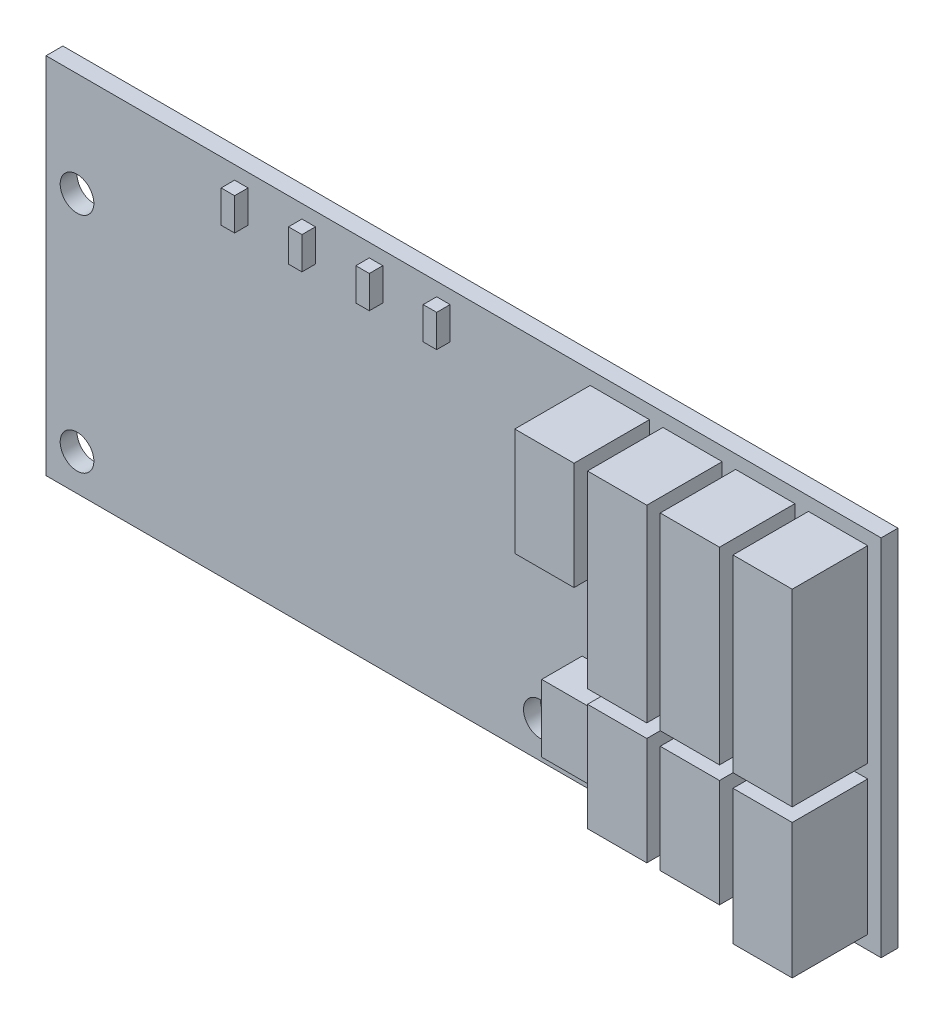
from build123d import *

# Parameters (mm, degrees)
SKETCH1_W           = 78.74
SKETCH1_H           = 34.29
BOSS_EXTRUDE1_DEPTH = 1.5875
CUT_EXTRUDE1_REACH  = 87.897
SKETCH2_R           = 1.5875
SKETCH3_W           = 5.588
SKETCH3_H           = 10.16
SKETCH3_H_2         = 17.78
SKETCH3_H_3         = 12.7
BOSS_EXTRUDE2_DEPTH = 7.112
SKETCH4_W           = 6.35
SKETCH4_H           = 6.35
BOSS_EXTRUDE3_DEPTH = 3.81
BOSS_EXTRUDE4_DEPTH = 4.0005
SKETCH6_W           = 1.27
SKETCH6_H           = 3.048
BOSS_EXTRUDE5_DEPTH = 1.27


with BuildPart() as part:
    # Sketch1 → Boss-Extrude1 (new body)
    with BuildSketch(Plane.XY):
        with Locations((39.37, 17.145)):
            Rectangle(SKETCH1_W, SKETCH1_H)
    extrude(amount=BOSS_EXTRUDE1_DEPTH)

    # Sketch2 → Cut-Extrude1 (cut, up to next)
    with BuildSketch(Plane.XY.offset(1.5875), mode=Mode.PRIVATE) as cut_extrude1_sk1:
        with Locations((2.921, 3.429)):
            Circle(SKETCH2_R)
    cut_extrude1_tool1 = extrude(cut_extrude1_sk1.sketch, amount=-CUT_EXTRUDE1_REACH, mode=Mode.PRIVATE) & part.part
    # Sketch2 → Cut-Extrude1 (cut, up to next)
    with BuildSketch(Plane.XY.offset(1.5875), mode=Mode.PRIVATE) as cut_extrude1_sk2:
        with Locations((2.921, 24.4856)):
            Circle(SKETCH2_R)
    cut_extrude1_tool2 = extrude(cut_extrude1_sk2.sketch, amount=-CUT_EXTRUDE1_REACH, mode=Mode.PRIVATE) & part.part
    # Sketch2 → Cut-Extrude1 (cut, up to next)
    with BuildSketch(Plane.XY.offset(1.5875), mode=Mode.PRIVATE) as cut_extrude1_sk3:
        with Locations((46.609, 24.4856)):
            Circle(SKETCH2_R)
    cut_extrude1_tool3 = extrude(cut_extrude1_sk3.sketch, amount=-CUT_EXTRUDE1_REACH, mode=Mode.PRIVATE) & part.part
    # Sketch2 → Cut-Extrude1 (cut, up to next)
    with BuildSketch(Plane.XY.offset(1.5875), mode=Mode.PRIVATE) as cut_extrude1_sk4:
        with Locations((46.609, 3.429)):
            Circle(SKETCH2_R)
    cut_extrude1_tool4 = extrude(cut_extrude1_sk4.sketch, amount=-CUT_EXTRUDE1_REACH, mode=Mode.PRIVATE) & part.part
    add(cut_extrude1_tool1.solids().sort_by_distance((2.921, 3.429, 1.5875))[0], mode=Mode.SUBTRACT)
    add(cut_extrude1_tool2.solids().sort_by_distance((2.921, 24.4856, 1.5875))[0], mode=Mode.SUBTRACT)
    add(cut_extrude1_tool3.solids().sort_by_distance((46.609, 24.4856, 1.5875))[0], mode=Mode.SUBTRACT)
    add(cut_extrude1_tool4.solids().sort_by_distance((46.609, 3.429, 1.5875))[0], mode=Mode.SUBTRACT)

    # Sketch3 → Boss-Extrude2 (add)
    with BuildSketch(Plane.XY.offset(1.5875)):
        with Locations((54.102, 27.94)):
            Rectangle(SKETCH3_W, SKETCH3_H)
        with Locations((60.96, 24.13)):
            Rectangle(SKETCH3_W, SKETCH3_H_2)
        with Locations((67.818, 24.13)):
            Rectangle(SKETCH3_W, SKETCH3_H_2)
        with Locations((74.676, 24.13)):
            Rectangle(SKETCH3_W, SKETCH3_H_2)
        with Locations((60.96, 8.89)):
            Rectangle(SKETCH3_W, SKETCH3_H)
        with Locations((67.818, 8.89)):
            Rectangle(SKETCH3_W, SKETCH3_H)
        with Locations((74.676, 7.62)):
            Rectangle(SKETCH3_W, SKETCH3_H_3)
    extrude(amount=BOSS_EXTRUDE2_DEPTH)

    # Sketch4 → Boss-Extrude3 (add)
    with BuildSketch(Plane.XY.offset(1.5875)):
        with Locations((53.721, 7.366)):
            Rectangle(SKETCH4_W, SKETCH4_H)
    extrude(amount=BOSS_EXTRUDE3_DEPTH)

    # Sketch5 → Boss-Extrude4 (add, symmetric)
    with BuildSketch(Plane(origin=(0, 15.875, 0), x_dir=(-1, 0, 0), z_dir=(0, -1, 0))):
        Polygon((-24.13, 9.525), (-19.177, 9.525), (-19.177, 0), (-17.907, 0), (-17.907, 8.128), (-7.493, 8.128), (-7.493, 0), (-6.223, 0), (-6.223, 9.525), (-1.27, 9.525), (-1.27, 10.16), (-6.858, 10.16), (-6.858, 8.763), (-18.542, 8.763), (-18.542, 10.16), (-24.13, 10.16), align=None)
    extrude(amount=BOSS_EXTRUDE4_DEPTH, both=True)

    # Sketch6 → Boss-Extrude5 (add)
    with BuildSketch(Plane.XY.offset(1.5875)):
        with Locations((37.465, 31.496)):
            Rectangle(SKETCH6_W, SKETCH6_H)
        with Locations((31.115, 31.496)):
            Rectangle(SKETCH6_W, SKETCH6_H)
        with Locations((24.765, 31.496)):
            Rectangle(SKETCH6_W, SKETCH6_H)
        with Locations((18.415, 31.496)):
            Rectangle(SKETCH6_W, SKETCH6_H)
    extrude(amount=BOSS_EXTRUDE5_DEPTH)


solid = part.part
